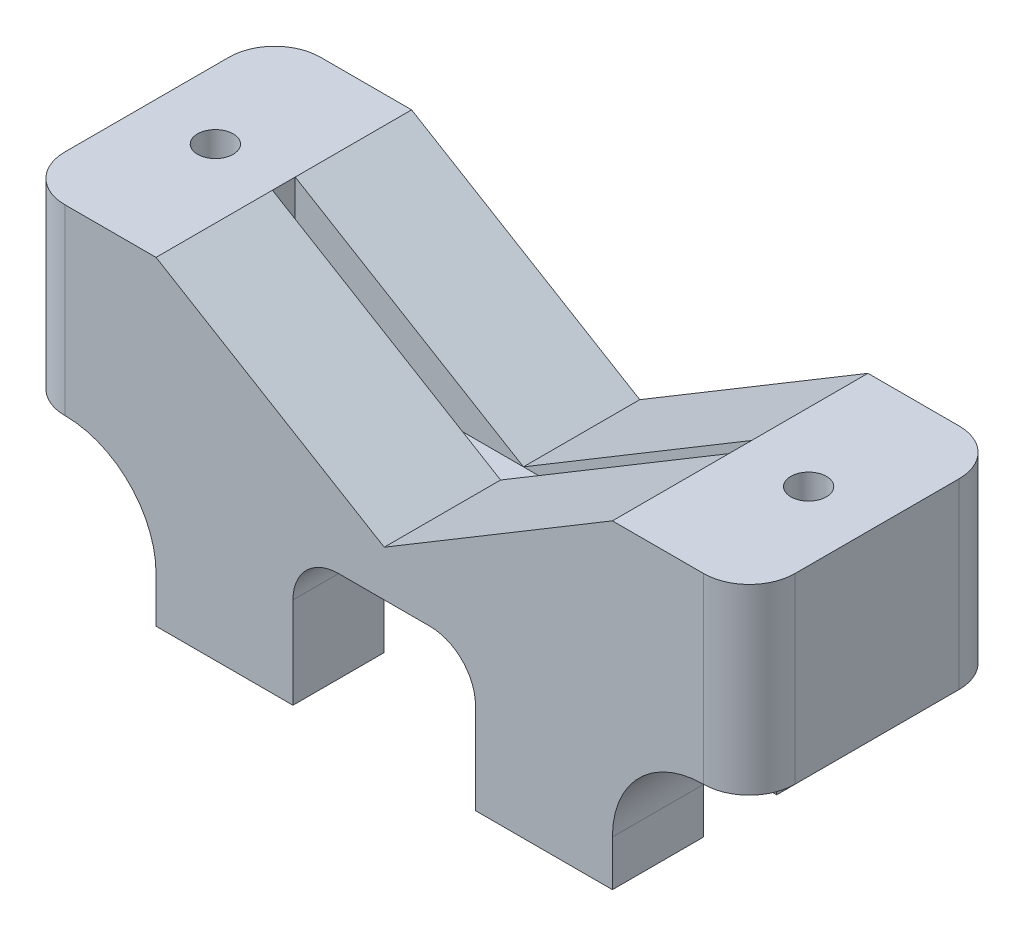
from build123d import *

# Parameters (mm, degrees)
SKETCH1_W                  = 15
SKETCH1_H                  = 10
BOSS_EXTRUDE1_DEPTH        = 15
BOSS_EXTRUDE1_2_DEPTH      = 15
BOSS_EXTRUDE1_3_DEPTH      = 15
BOSS_EXTRUDE1_4_DEPTH      = 15
SKETCH2_W                  = 50
SKETCH2_H                  = 28
BOSS_EXTRUDE2_DEPTH        = 5
SKETCH4_W                  = 80
SKETCH4_H                  = 28
BOSS_EXTRUDE3_DEPTH        = 20
CUT_EXTRUDE1_DEPTH         = 20
CUT_EXTRUDE1_DEPTH_BACK    = 20
CUT_EXTRUDE2_DEPTH         = 1.25
M3_5_CLEARANCE_HOLE1_D     = 3.9
M3_5_CLEARANCE_HOLE1_DEPTH = 15
M3_5_CLEARANCE_HOLE1_TIP   = 1.171678207
FILLET1_R                  = 10
FILLET2_R                  = 5
FILLET3_R                  = 5


with BuildPart() as part:
    # Sketch1 → Boss-Extrude1 (new body)
    with BuildSketch(Plane(origin=(0, 0, 0), x_dir=(1, 0, 0), z_dir=(0, 1, 0))):
        with Locations((-17.5, 9)):
            Rectangle(SKETCH1_W, SKETCH1_H)
    extrude(amount=-BOSS_EXTRUDE1_DEPTH)



with BuildPart() as body_2:
    # Sketch1 → Boss-Extrude1 2 (new body)
    with BuildSketch(Plane(origin=(0, 0, 0), x_dir=(1, 0, 0), z_dir=(0, 1, 0))):
        with Locations((17.5, 9)):
            Rectangle(SKETCH1_W, SKETCH1_H)
    extrude(amount=-BOSS_EXTRUDE1_2_DEPTH)


with BuildPart() as body_3:
    # Sketch1 → Boss-Extrude1 3 (new body)
    with BuildSketch(Plane(origin=(0, 0, 0), x_dir=(1, 0, 0), z_dir=(0, 1, 0))):
        with Locations((17.5, -9)):
            Rectangle(SKETCH1_W, SKETCH1_H)
    extrude(amount=-BOSS_EXTRUDE1_3_DEPTH)


with BuildPart() as body_4:
    # Sketch1 → Boss-Extrude1 4 (new body)
    with BuildSketch(Plane(origin=(0, 0, 0), x_dir=(1, 0, 0), z_dir=(0, 1, 0))):
        with Locations((-17.5, -9)):
            Rectangle(SKETCH1_W, SKETCH1_H)
    extrude(amount=-BOSS_EXTRUDE1_4_DEPTH)


with BuildPart() as part_1:
    add(part.part)

    add(body_2.part)  # Boss-Extrude2 merges body 2

    add(body_3.part)  # Boss-Extrude2 merges body 3

    add(body_4.part)  # Boss-Extrude2 merges body 4
    # Sketch2 → Boss-Extrude2 (add)
    with BuildSketch(Plane(origin=(0, 0, 0), x_dir=(1, 0, 0), z_dir=(0, 1, 0))):
        Rectangle(SKETCH2_W, SKETCH2_H)
    extrude(amount=BOSS_EXTRUDE2_DEPTH)

    # Sketch4 → Boss-Extrude3 (add)
    with BuildSketch(Plane(origin=(0, 0, 0), x_dir=(1, 0, 0), z_dir=(0, 1, 0))):
        Rectangle(SKETCH4_W, SKETCH4_H)
    extrude(amount=BOSS_EXTRUDE3_DEPTH)

    # Sketch5 → Cut-Extrude1 (cut, two sides: drawn at the far end of the back side and taken through both)
    with BuildSketch(Plane.XY.offset(-CUT_EXTRUDE1_DEPTH_BACK)):
        Polygon((-25, 20), (25, 20), (0, 5), align=None)
    extrude(amount=CUT_EXTRUDE1_DEPTH + CUT_EXTRUDE1_DEPTH_BACK, mode=Mode.SUBTRACT)

    # Sketch6 → Cut-Extrude2 (cut, symmetric)
    with BuildSketch(Plane.XY):
        Polygon((-25, 20), (-25, 5), (0, 5), align=None)
    cut_extrude2 = extrude(amount=CUT_EXTRUDE2_DEPTH, both=True, mode=Mode.SUBTRACT)

    # Mirror1: Cut-Extrude2 across plane
    add(cut_extrude2.mirror(Plane(origin=(0, 0, 0), x_dir=(0, 0, 1), z_dir=(1, 0, 0))), mode=Mode.SUBTRACT)

    # M3.5 Clearance Hole1
    with Locations(Plane(origin=(0, 20, 0), x_dir=(1, 0, 0), z_dir=(0, 1, 0))):
        with Locations((32.5, 0), (-32.5, 0)):
            Hole(M3_5_CLEARANCE_HOLE1_D / 2, depth=M3_5_CLEARANCE_HOLE1_DEPTH)
            with Locations((0, 0, -(M3_5_CLEARANCE_HOLE1_DEPTH + M3_5_CLEARANCE_HOLE1_TIP / 2))):  # 118° drill point
                Cone(0, M3_5_CLEARANCE_HOLE1_D / 2, M3_5_CLEARANCE_HOLE1_TIP, mode=Mode.SUBTRACT)

    # Fillet1
    fillet1_edges = [part_1.edges().sort_by_distance(p)[0] for p in [
        (-25, 0, -9),
        (-25, 0, 9),
        (25, 0, 9),
        (25, 0, -9),
    ]]
    fillet(fillet1_edges, radius=FILLET1_R)

    # Fillet2
    fillet2_edges = [part_1.edges().sort_by_distance(p)[0] for p in [
        (10, 0, -9),
        (10, 0, 9),
        (-10, 0, 9),
        (-10, 0, -9),
    ]]
    fillet(fillet2_edges, radius=FILLET2_R)

    # Fillet3
    fillet3_edges = [part_1.edges().sort_by_distance(p)[0] for p in [
        (-40, 10, -14),
        (-40, 10, 14),
        (40, 10, 14),
        (40, 10, -14),
    ]]
    fillet(fillet3_edges, radius=FILLET3_R)


solid = part_1.part
